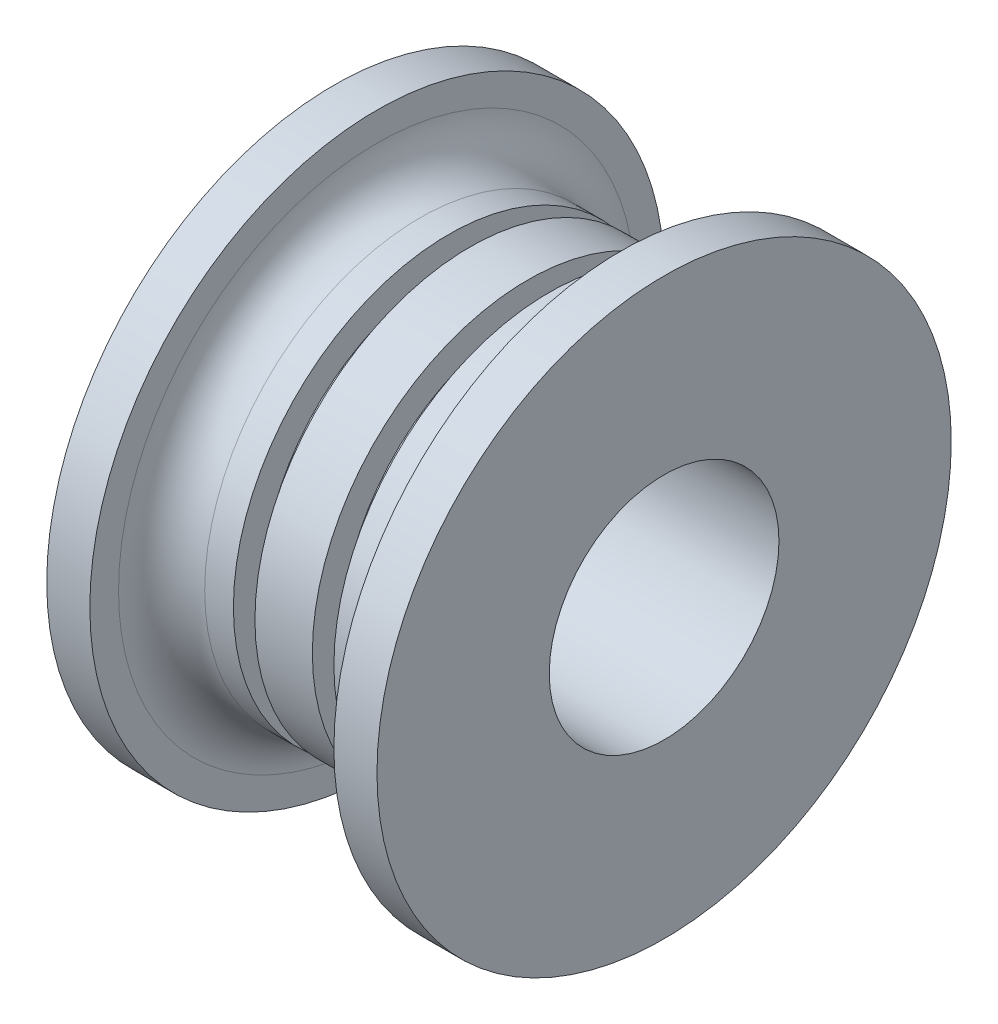
from build123d import *


with BuildPart() as part:
    # Esquisse2 → Révolution1 (revolve)
    with BuildSketch(Plane.XY, mode=Mode.PRIVATE) as r_volution1_sk:
        with BuildLine():
            Line((230, 200), (230, 80))
            Line((230, 80), (0, 80))
            Line((0, 80), (0, 200))
            Line((0, 200), (30, 200))
            Line((30, 200), (30, 180))
            ThreePointArc((30, 180), (38.786796564, 158.786796564), (60, 150))
            Line((60, 150), (80, 150))
            Line((80, 150), (80, 130))
            Line((80, 130), (95, 130))
            Line((95, 130), (95, 150))
            Line((95, 150), (135, 150))
            Line((135, 150), (135, 130))
            Line((135, 130), (150, 130))
            Line((150, 130), (150, 150))
            Line((150, 150), (170, 150))
            ThreePointArc((170, 150), (191.213203436, 158.786796564), (200, 180))
            Line((200, 180), (200, 200))
            Line((200, 200), (230, 200))
        make_face()
    revolve(r_volution1_sk.sketch.rotate(Axis((0, 0, 0), (1, 0, 0)), 90), axis=Axis((0, 0, 0), (1, 0, 0)))


solid = part.part
